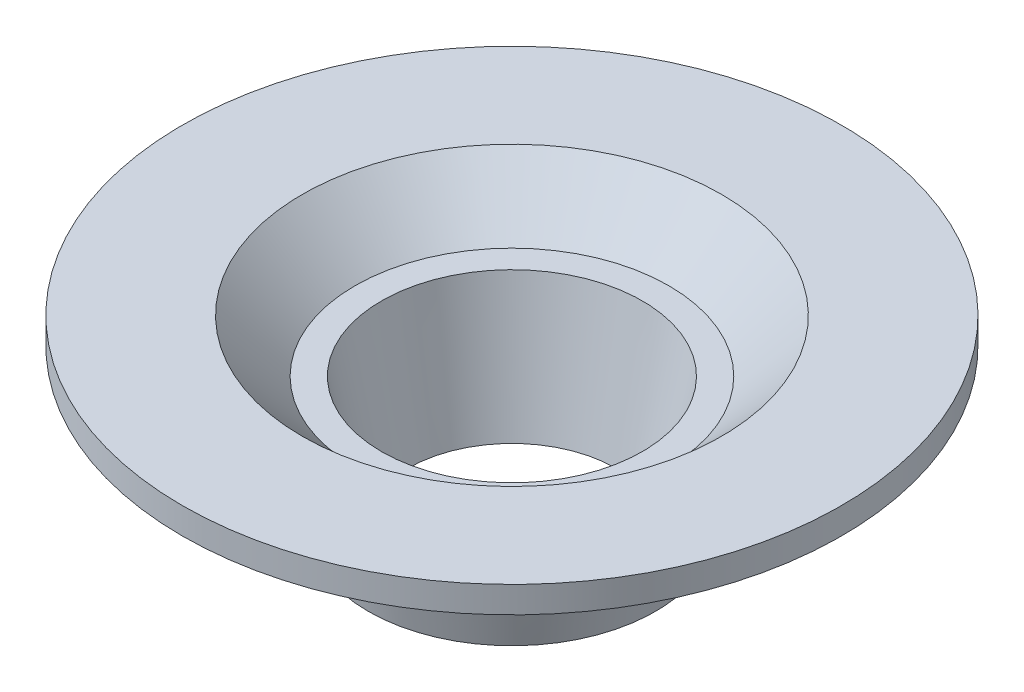
from build123d import *


with BuildPart() as part:
    # Sketch1 → Revolve1 (revolve)
    with BuildSketch(Plane.XY, mode=Mode.PRIVATE) as revolve1_sk:
        Polygon((4.95, 0), (5.95, 0), (7.95, 2), (12.5, 2), (12.5, 1), (10.5, 1), (8.5, -1), (6.25, -1), (5.45, -5), (3.95, -5), align=None)
    revolve(revolve1_sk.sketch.rotate(Axis((0, 0, 0), (0, -1, 0)), 90), axis=Axis((0, 0, 0), (0, -1, 0)))


solid = part.part
